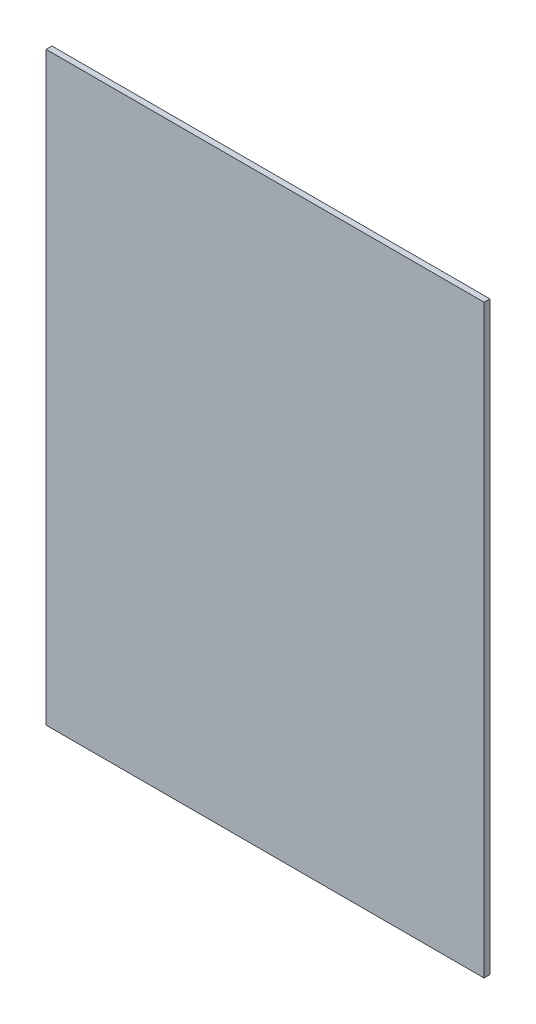
from build123d import *

# Parameters (mm, degrees)
SKETCH1_W           = 150.1
SKETCH1_H           = 200.6
BOSS_EXTRUDE1_DEPTH = 2


with BuildPart() as part:
    # Sketch1 → Boss-Extrude1 (new body)
    with BuildSketch(Plane.XY):
        Rectangle(SKETCH1_W, SKETCH1_H)
    extrude(amount=BOSS_EXTRUDE1_DEPTH)


solid = part.part
